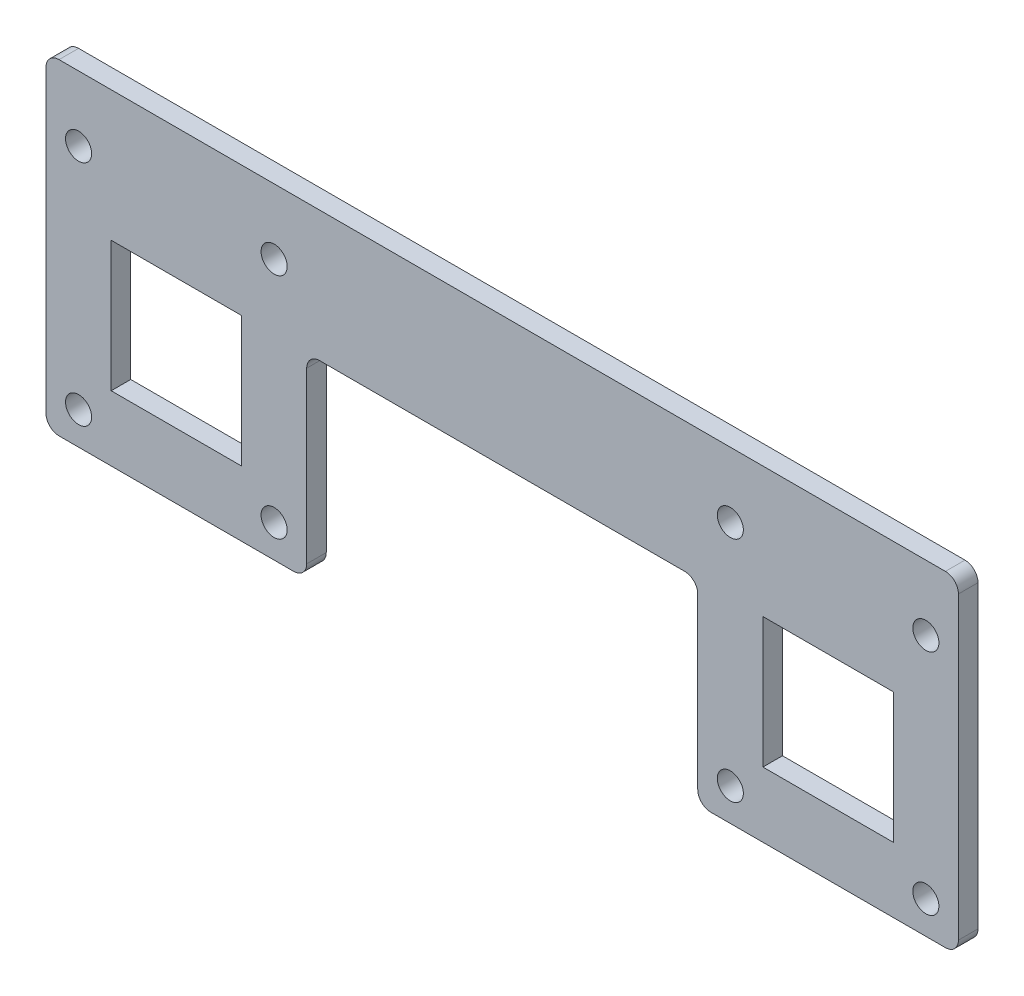
from build123d import *

# Parameters (mm, degrees)
SKETCH_1_W          = 140
SKETCH_1_H          = 50
EXTRUDE_1_DEPTH     = 3
SKETCH_2_W          = 20
SKETCH_2_H          = 20
CUT_EXTRUDE_1_DEPTH = 3
SKETCH_3_W          = 60
SKETCH_3_H          = 30
CUT_EXTRUDE_2_DEPTH = 3
SKETCH_4_R          = 2
CUT_EXTRUDE_4_DEPTH = 3
SKETCH_5_R          = 2
CUT_EXTRUDE_5_DEPTH = 3
FILLET_1_R          = 2


with BuildPart() as part:
    # 草图1 → 凸台-拉伸1 (new body)
    with BuildSketch(Plane.XY):
        Rectangle(SKETCH_1_W, SKETCH_1_H)
    extrude(amount=EXTRUDE_1_DEPTH)

    # 草图2 → 切除-拉伸1 (cut)
    with BuildSketch(Plane.XY.offset(3)):
        with Locations((-50, -5)):
            Rectangle(SKETCH_2_W, SKETCH_2_H)
        with Locations((50, -5)):
            Rectangle(SKETCH_2_W, SKETCH_2_H)
    extrude(amount=-CUT_EXTRUDE_1_DEPTH, mode=Mode.SUBTRACT)

    # 草图3 → 切除-拉伸2 (cut)
    with BuildSketch(Plane.XY.offset(3)):
        with Locations((0, -10)):
            Rectangle(SKETCH_3_W, SKETCH_3_H)
    extrude(amount=-CUT_EXTRUDE_2_DEPTH, mode=Mode.SUBTRACT)

    # 草图4 → 切除-拉伸4 (cut)
    with BuildSketch(Plane.XY.offset(3)):
        with Locations((-65, -20)):
            Circle(SKETCH_4_R)
        with Locations((-35, -20)):
            Circle(SKETCH_4_R)
        with Locations(Location((65, -20, 0), (0, 0, 180))):
            Circle(SKETCH_4_R)
        with Locations(Location((35, -20, 0), (0, 0, 180))):
            Circle(SKETCH_4_R)
    extrude(amount=-CUT_EXTRUDE_4_DEPTH, mode=Mode.SUBTRACT)

    # 草图5 → 切除-拉伸5 (cut)
    with BuildSketch(Plane.XY.offset(3)):
        with Locations((-65, 15)):
            Circle(SKETCH_5_R)
        with Locations((-35, 15)):
            Circle(SKETCH_5_R)
        with Locations(Location((35, 15, 0), (0, 0, 180))):
            Circle(SKETCH_5_R)
        with Locations(Location((65, 15, 0), (0, 0, 180))):
            Circle(SKETCH_5_R)
    extrude(amount=-CUT_EXTRUDE_5_DEPTH, mode=Mode.SUBTRACT)

    # 圆角1
    fillet_1_edges = [part.edges().sort_by_distance(p)[0] for p in [
        (30, 5, 1.5),
        (30, -25, 1.5),
        (-30, -25, 1.5),
        (-30, 5, 1.5),
        (70, -25, 1.5),
        (-70, -25, 1.5),
        (-70, 25, 1.5),
        (70, 25, 1.5),
    ]]
    fillet(fillet_1_edges, radius=FILLET_1_R)


solid = part.part
